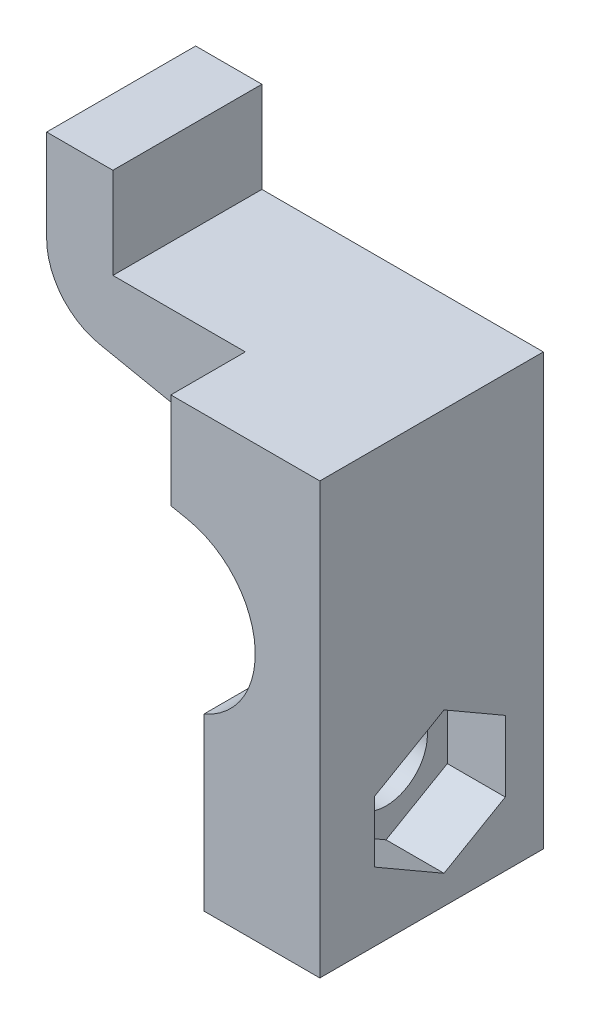
from build123d import *

# Parameters (mm, degrees)
BOSS_EXTRUDE1_DEPTH = 9
SKETCH2_R           = 2.5
CUT_EXTRUDE1_DEPTH  = 39.913365313
BOSS_EXTRUDE2_DEPTH = 4.5
CUT_EXTRUDE2_DEPTH  = 3.5


with BuildPart() as part:
    # Sketch1 → Boss-Extrude1 (new body)
    with BuildSketch(Plane.XY):
        with BuildLine():
            Line((0, 0), (0, -5.580710666))
            ThreePointArc((0, -5.580710666), (0.901780583, -8.110737631), (3.200518222, -9.5))
            Line((3.200518222, -9.5), (13.019339267, -11.502906099))
            ThreePointArc((13.019339267, -11.502906099), (17.074073947, -15.986411077), (14, -21.191481642))
            Line((14, -21.191481642), (14, -31.5))
            Line((14, -31.5), (21, -31.5))
            Line((21, -31.5), (21, -5.5))
            Line((21, -5.5), (4, -5.5))
            Line((4, -5.5), (4, 0))
            Line((4, 0), (0, 0))
        make_face()
    extrude(amount=BOSS_EXTRUDE1_DEPTH)

    # Sketch2 → Cut-Extrude1 (cut, through all)
    with BuildSketch(Plane(origin=(21, 0, 0), x_dir=(0, 0, -1), z_dir=(1, 0, 0))):
        with Locations((-6, -25.5)):
            Circle(SKETCH2_R)
    extrude(amount=-CUT_EXTRUDE1_DEPTH, mode=Mode.SUBTRACT)

    # Sketch3 → Boss-Extrude2 (add)
    with BuildSketch(Plane.XY.offset(9)):
        with BuildLine():
            Line((12, -5.5), (12, -11.294974737))
            Line((12, -11.294974737), (13.019339267, -11.502906099))
            ThreePointArc((13.019339267, -11.502906099), (17.074073947, -15.986411077), (14, -21.191481642))
            Line((14, -21.191481642), (14, -31.5))
            Line((14, -31.5), (21, -31.5))
            Line((21, -31.5), (21, -5.5))
            Line((21, -5.5), (12, -5.5))
        make_face()
    extrude(amount=BOSS_EXTRUDE2_DEPTH)

    # Sketch4 → Cut-Extrude2 (cut)
    with BuildSketch(Plane(origin=(21, 0, 0), x_dir=(0, 0, -1), z_dir=(1, 0, 0))):
        Polygon((-10.2, -23.652479139), (-10.2, -27.347520861), (-6, -29.772391992), (-2.3, -27.636195996), (-2.3, -23.363804004), (-6, -21.227608008), align=None)
    extrude(amount=-CUT_EXTRUDE2_DEPTH, mode=Mode.SUBTRACT)


solid = part.part
